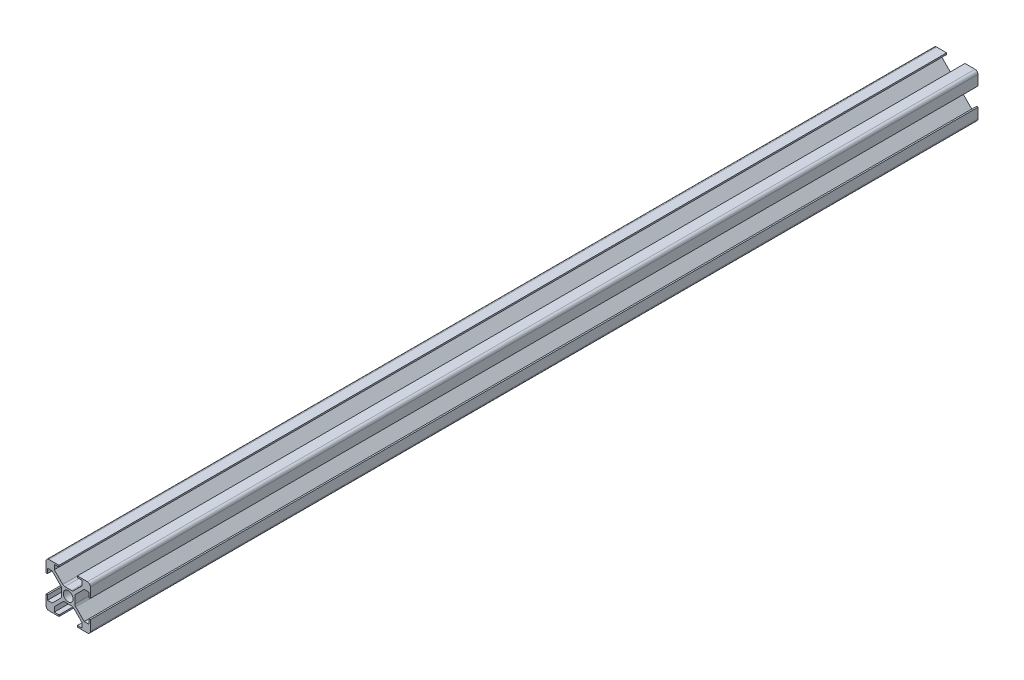
from build123d import *

# Parameters (mm, degrees)
SKETCH_1_R      = 1.65
EXTRUDE_1_DEPTH = 300
FILLET_1_R      = 1


with BuildPart() as part:
    # 草图1 → 凸台-拉伸1 (new body)
    with BuildSketch(Plane.XY):
        Polygon((7.5, 7.5), (7.5, 3.1), (7, 3.1), (7, 4.7), (5.407106781, 4.7), (2.254923973, 1.547817192), (2.254923973, 0), (2.254923973, -1.547817192), (5.407106781, -4.7), (7, -4.7), (7, -3.1), (7.5, -3.1), (7.5, -7.5), (3.1, -7.5), (3.1, -7), (4.7, -7), (4.7, -5.407106781), (1.547817192, -2.254923973), (0, -2.254923973), (-1.547817192, -2.254923973), (-4.7, -5.407106781), (-4.7, -7), (-3.1, -7), (-3.1, -7.5), (-7.5, -7.5), (-7.5, -3.1), (-7, -3.1), (-7, -4.7), (-5.407106781, -4.7), (-2.254923973, -1.547817192), (-2.254923973, 0), (-2.254923973, 1.547817192), (-5.407106781, 4.7), (-7, 4.7), (-7, 3.1), (-7.5, 3.1), (-7.5, 7.5), (-3.1, 7.5), (-3.1, 7), (-4.7, 7), (-4.7, 5.407106781), (-1.547817192, 2.254923973), (0, 2.254923973), (1.547817192, 2.254923973), (4.7, 5.407106781), (4.7, 7), (3.1, 7), (3.1, 7.5), align=None)
        Circle(SKETCH_1_R, mode=Mode.SUBTRACT)
    extrude(amount=EXTRUDE_1_DEPTH)

    # 圆角1
    fillet_1_edges = [part.edges().sort_by_distance(p)[0] for p in [
        (7.5, 7.5, 150),
        (2.254923973, -1.547817192, 150),
        (7.5, -7.5, 150),
        (1.547817192, -2.254923973, 150),
        (-1.547817192, -2.254923973, 150),
        (-7.5, -7.5, 150),
        (-2.254923973, -1.547817192, 150),
        (-7.5, 7.5, 150),
        (-1.547817192, 2.254923973, 150),
        (1.547817192, 2.254923973, 150),
    ]]
    fillet(fillet_1_edges, radius=FILLET_1_R)


solid = part.part
